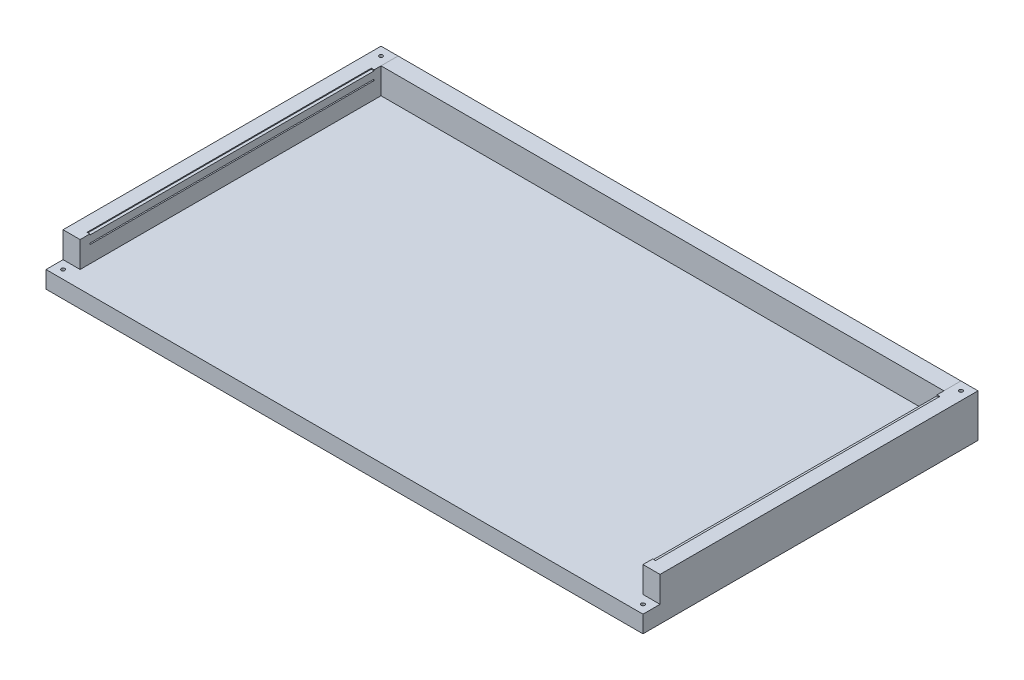
from build123d import *

# Parameters (mm, degrees)
BOSS_EXTRUDE1_DEPTH = 559.25
SKETCH4_W           = 1980
SKETCH4_H           = 60
BOSS_EXTRUDE2_DEPTH = 151.2
CUT_EXTRUDE2_START  = 25
SKETCH6_W           = 2000
SKETCH6_H           = 3.3
SKETCH6_H_2         = 4.4
CUT_EXTRUDE2_DEPTH  = 500
CUT_EXTRUDE3_START  = 151.2
SKETCH7_R           = 6.35
CUT_EXTRUDE3_DEPTH  = 1351.417245748
SKETCH8_W           = 2100
SKETCH8_H           = 60
BOSS_EXTRUDE3_DEPTH = 60
SKETCH9_R           = 6.35
CUT_EXTRUDE4_DEPTH  = 60


with BuildPart() as part:
    # Sketch3 → Boss-Extrude1 (new, symmetric)
    with BuildSketch(Plane.XY):
        Polygon((-990, 60), (990, 60), (990, 151.2), (1050, 151.2), (1050, 0), (-1050, 0), (-1050, 151.2), (-990, 151.2), align=None)
    extrude(amount=BOSS_EXTRUDE1_DEPTH, both=True)

    # Sketch6 → Cut-Extrude2 (cut, symmetric)
    with BuildSketch(Plane.XY.offset(CUT_EXTRUDE2_START)):
        with Locations((0, 149.55)):
            Rectangle(SKETCH6_W, SKETCH6_H)
        with Locations((0, 120.7)):
            Rectangle(SKETCH6_W, SKETCH6_H_2)
    extrude(amount=CUT_EXTRUDE2_DEPTH, both=True, mode=Mode.SUBTRACT)

    # Sketch7 → Cut-Extrude3 (cut, through all)
    with BuildSketch(Plane(origin=(0, 0, 0), x_dir=(1, 0, 0), z_dir=(0, 1, 0)).offset(CUT_EXTRUDE3_START)):
        with Locations(Location((1020, 529.25, 0), (0, 0, 90))):
            Circle(SKETCH7_R)
        with Locations(Location((-1020, 529.25, 0), (0, 0, 90))):
            Circle(SKETCH7_R)
    extrude(amount=-CUT_EXTRUDE3_DEPTH, mode=Mode.SUBTRACT)

    # Sketch8 → Boss-Extrude3 (add)
    with BuildSketch(Plane(origin=(0, 0, 0), x_dir=(1, 0, 0), z_dir=(0, 1, 0))):
        with Locations((0, -589.25)):
            Rectangle(SKETCH8_W, SKETCH8_H)
    extrude(amount=BOSS_EXTRUDE3_DEPTH)

    # Sketch9 → Cut-Extrude4 (cut)
    with BuildSketch(Plane(origin=(0, 0, 0), x_dir=(1, 0, 0), z_dir=(0, 1, 0))):
        with Locations(Location((-1020, -589.25, 0), (0, 0, 90))):
            Circle(SKETCH9_R)
        with Locations(Location((1020, -589.25, 0), (0, 0, 90))):
            Circle(SKETCH9_R)
    extrude(amount=CUT_EXTRUDE4_DEPTH, mode=Mode.SUBTRACT)


with BuildPart() as body_2:
    # Sketch4 → Boss-Extrude2 (new body)
    with BuildSketch(Plane(origin=(0, 0, 0), x_dir=(1, 0, 0), z_dir=(0, 1, 0))):
        with Locations((0, 529.25)):
            Rectangle(SKETCH4_W, SKETCH4_H)
    extrude(amount=BOSS_EXTRUDE2_DEPTH)


solid = Compound([part.part, body_2.part])
